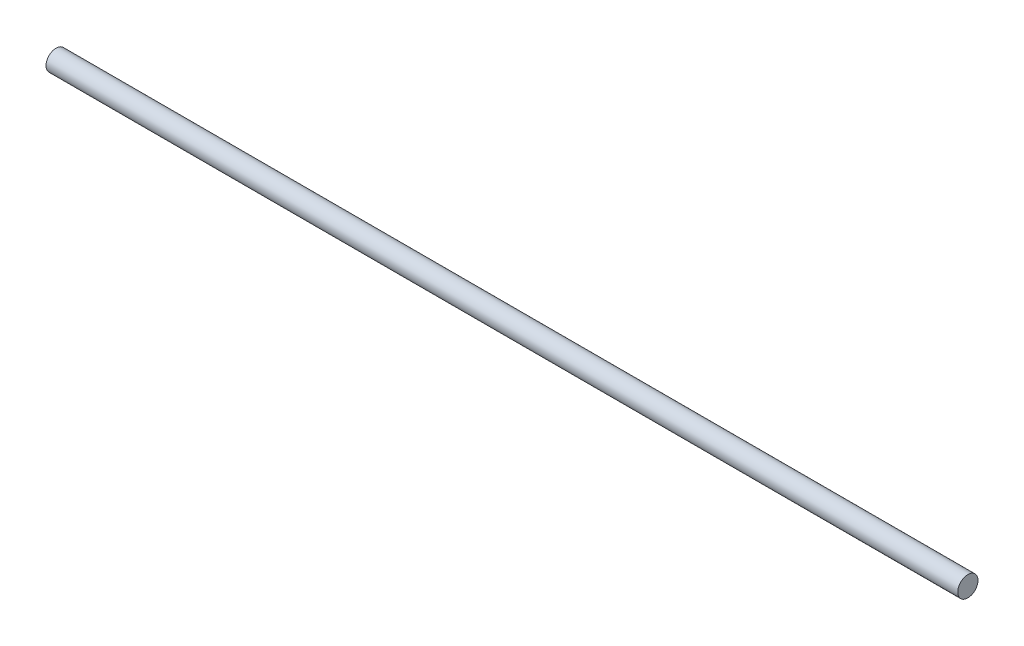
from build123d import *

# Parameters (mm, degrees)
SKETCH1_R           = 5
BOSS_EXTRUDE1_DEPTH = 225


with BuildPart() as part:
    # Sketch1 → Boss-Extrude1 (new, symmetric)
    with BuildSketch(Plane(origin=(0, 0, 0), x_dir=(0, 0, -1), z_dir=(1, 0, 0))):
        Circle(SKETCH1_R)
    extrude(amount=BOSS_EXTRUDE1_DEPTH, both=True)


solid = part.part
